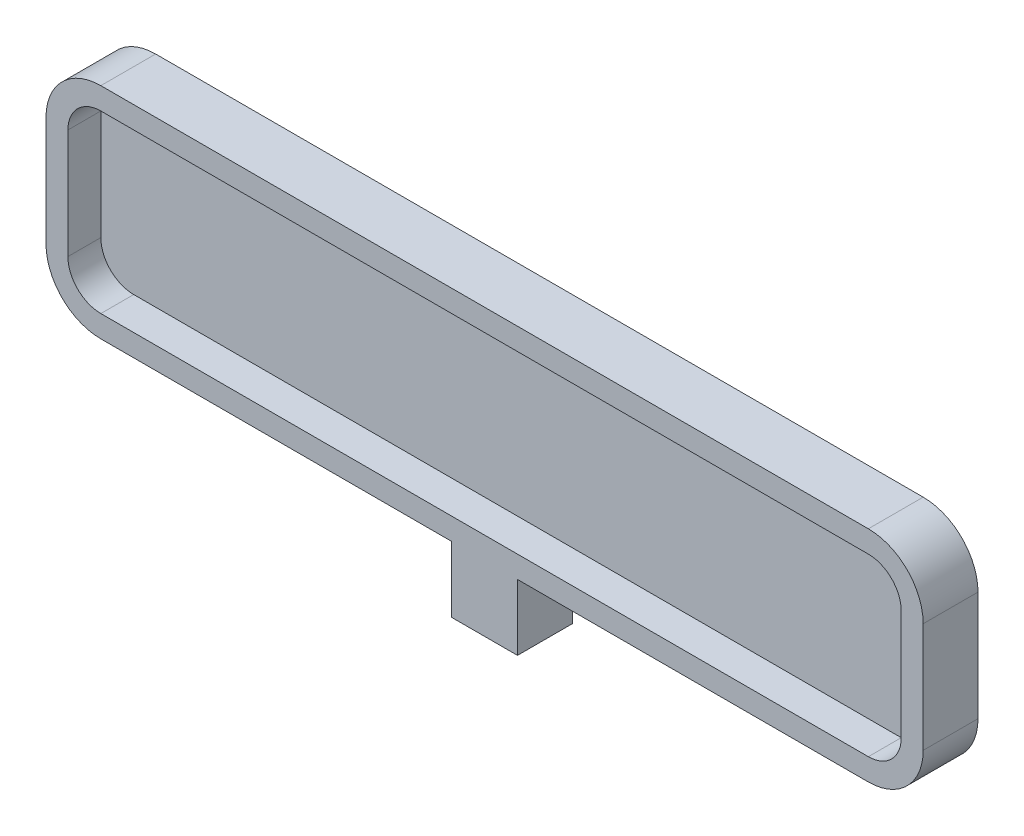
from build123d import *

# Parameters (mm, degrees)
SKETCH1_W           = 80
SKETCH1_H           = 20
BOSS_EXTRUDE1_DEPTH = 2.5
FILLET1_R           = 5
SHELL1_T            = -2
SKETCH2_W           = 6
SKETCH2_H           = 5
BOSS_EXTRUDE2_DEPTH = 6
SKETCH3_R           = 1.425
CUT_EXTRUDE1_DEPTH  = 4


with BuildPart() as part:
    # Sketch1 → Boss-Extrude1 (new, symmetric)
    with BuildSketch(Plane.XY):
        Rectangle(SKETCH1_W, SKETCH1_H)
    extrude(amount=BOSS_EXTRUDE1_DEPTH, both=True)

    # Fillet1
    fillet1_edges = [part.edges().sort_by_distance(p)[0] for p in [
        (40, -10, 0),
        (-40, -10, 0),
        (-40, 10, 0),
        (40, 10, 0),
    ]]
    fillet(fillet1_edges, radius=FILLET1_R)

    # Shell1
    shell1_openings = [part.faces().sort_by_distance(p)[0] for p in [
        (0, 0, 2.5),
    ]]
    offset(amount=SHELL1_T, openings=shell1_openings, kind=Kind.INTERSECTION)

    # Sketch2 → Boss-Extrude2 (add)
    with BuildSketch(Plane.XZ.offset(10)):
        Rectangle(SKETCH2_W, SKETCH2_H)
    extrude(amount=BOSS_EXTRUDE2_DEPTH)

    # Sketch3 → Cut-Extrude1 (cut)
    with BuildSketch(Plane.XZ.offset(16)):
        with Locations(Location((0, 0, 0), (0, 0, 270))):
            Circle(SKETCH3_R)
    extrude(amount=-CUT_EXTRUDE1_DEPTH, mode=Mode.SUBTRACT)


solid = part.part
